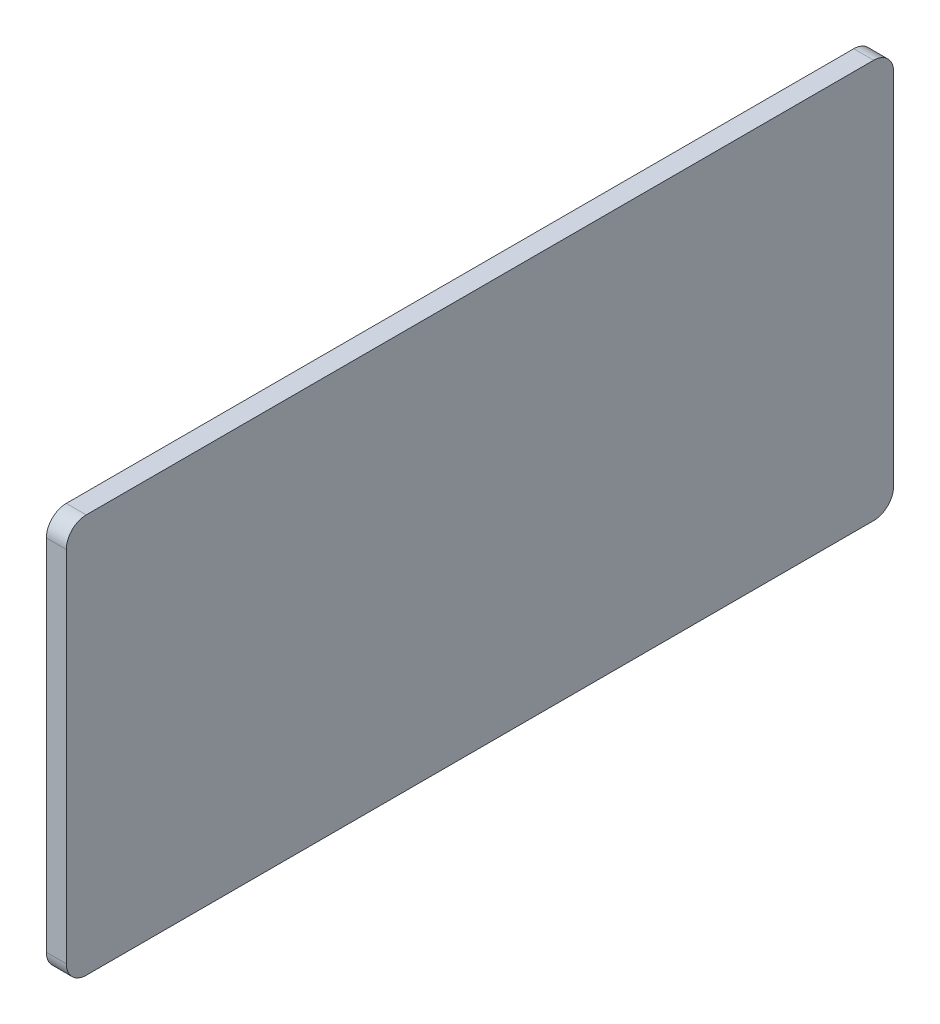
from build123d import *

# Parameters (mm, degrees)
BOSS_EXTRU_1_DEPTH = 2


with BuildPart() as part:
    # Esquisse1 → Boss.-Extru.1 (new body)
    with BuildSketch(Plane(origin=(0, 0, 0), x_dir=(0, 0, -1), z_dir=(1, 0, 0))):
        with BuildLine():
            Line((39.5, -20), (-39.5, -20))
            ThreePointArc((-39.5, -20), (-40.914213562, -19.414213562), (-41.5, -18))
            Line((-41.5, -18), (-41.5, 18))
            ThreePointArc((-41.5, 18), (-40.914213562, 19.414213562), (-39.5, 20))
            Line((-39.5, 20), (39.5, 20))
            ThreePointArc((39.5, 20), (40.914213562, 19.414213562), (41.5, 18))
            Line((41.5, 18), (41.5, -18))
            ThreePointArc((41.5, -18), (40.914213562, -19.414213562), (39.5, -20))
        make_face()
    extrude(amount=BOSS_EXTRU_1_DEPTH)


solid = part.part
